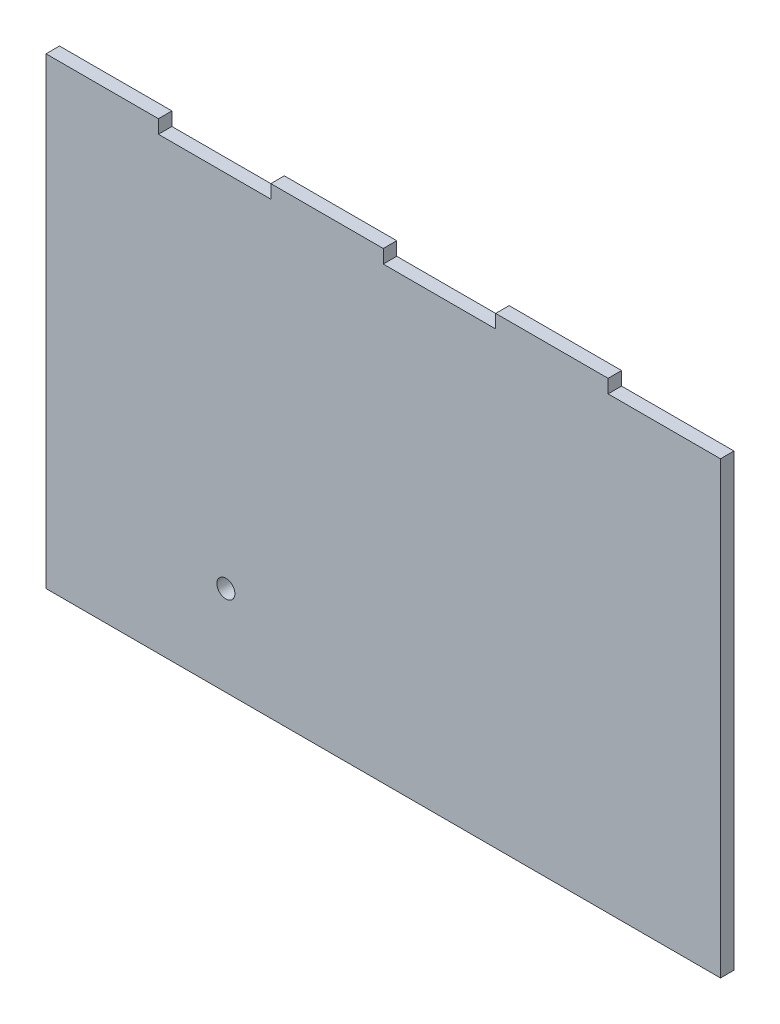
from build123d import *

# Parameters (mm, degrees)
ESQUISSE1_R        = 4
BOSS_EXTRU_1_DEPTH = 6


with BuildPart() as part:
    # Esquisse1 → Boss.-Extru.1 (new body)
    with BuildSketch(Plane.XY):
        Polygon((0, 200), (0, 206), (50, 206), (50, 200), (100, 200), (100, 206), (150, 206), (150, 200), (200, 200), (200, 206), (250, 206), (250, 200), (300, 200), (300, 0), (0, 0), align=None)
        with Locations((80, 40)):
            Circle(ESQUISSE1_R, mode=Mode.SUBTRACT)
    extrude(amount=BOSS_EXTRU_1_DEPTH)


solid = part.part
